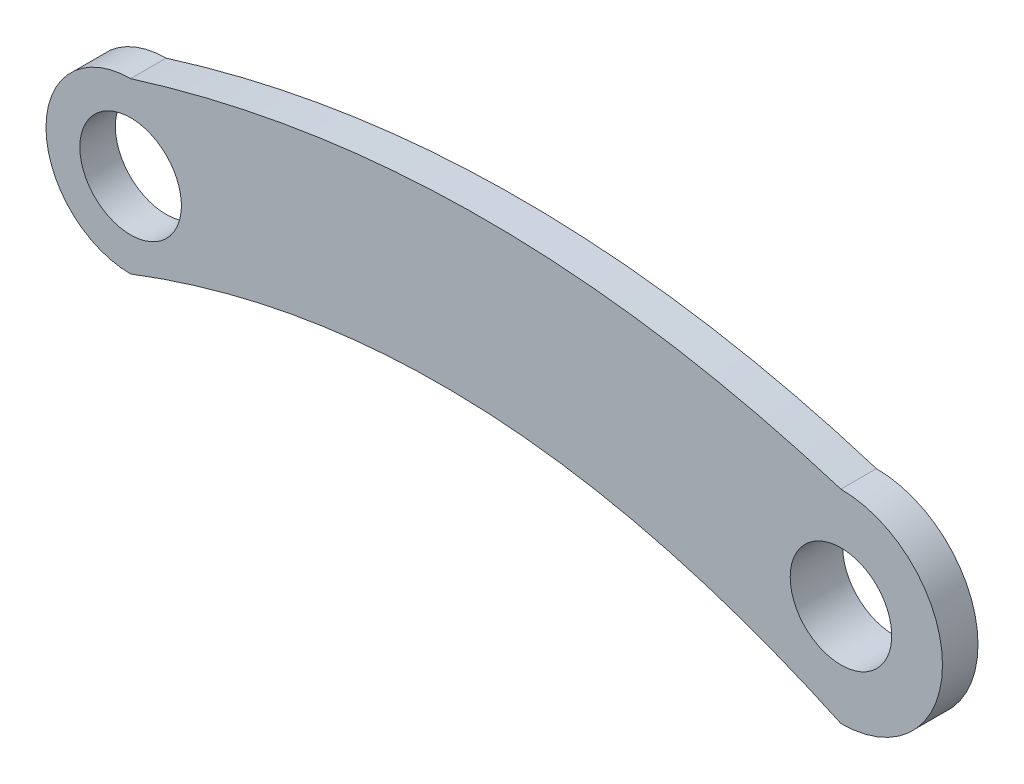
from build123d import *
from build123d.topology import SkipClean

# Parameters (mm, degrees)
BOSS_EXTRUDE1_DEPTH = 21
SKETCH2_R           = 30
CUT_EXTRUDE1_DEPTH  = 527.362693656
BOSS_EXTRUDE2_START = 10
SKETCH3_R           = 40
SKETCH3_R_2         = 30
BOSS_EXTRUDE2_DEPTH = 10


with BuildPart() as part:
    # Sketch1 → Boss-Extrude1 (new body)
    with BuildSketch(Plane.XY):
        with BuildLine():
            add(Edge.make_bspline(
                [(-267.733324074, 386.480114093), (-58.376892778, 451.86591416), (152.142574227, 386.270803333)],
                knots=[0, 0, 0, 1, 1, 1], degree=2))
            ThreePointArc((-267.733324074, 386.480114093), (-317.733324074, 336.480114093), (-267.733324074, 286.480114093))
            add(Edge.make_bspline(
                [(-267.733324074, 286.480114093), (-61.536299878, 365.758634067), (152.142574227, 266.270803333)],
                knots=[0, 0, 0, 1, 1, 1], degree=2))
            ThreePointArc((152.142574227, 266.270803333), (212.142574227, 326.270803333), (152.142574227, 386.270803333))
        make_face()
    extrude(amount=BOSS_EXTRUDE1_DEPTH)

    # Sketch2 → Cut-Extrude1 (cut, through all)
    with BuildSketch(Plane.XY):
        with Locations((-267.733324074, 336.480114093)):
            Circle(SKETCH2_R)
        with Locations((152.142574227, 326.270803333)):
            Circle(SKETCH2_R)
    extrude(amount=CUT_EXTRUDE1_DEPTH, mode=Mode.SUBTRACT)

    # Sketch3 → Boss-Extrude2 (add)
    with SkipClean():  # the faces are left unmerged after this step: merging them gives an invalid solid
        with BuildSketch(Plane(origin=(0, 0, 0), x_dir=(-1, 0, 0), z_dir=(0, 0, -1)).offset(BOSS_EXTRUDE2_START)):
            with Locations((-152.142574227, 326.270803333)):
                Circle(SKETCH3_R)
            with Locations((-152.142574227, 326.270803333)):
                Circle(SKETCH3_R_2, mode=Mode.SUBTRACT)
        extrude(amount=-BOSS_EXTRUDE2_DEPTH)


solid = part.part
